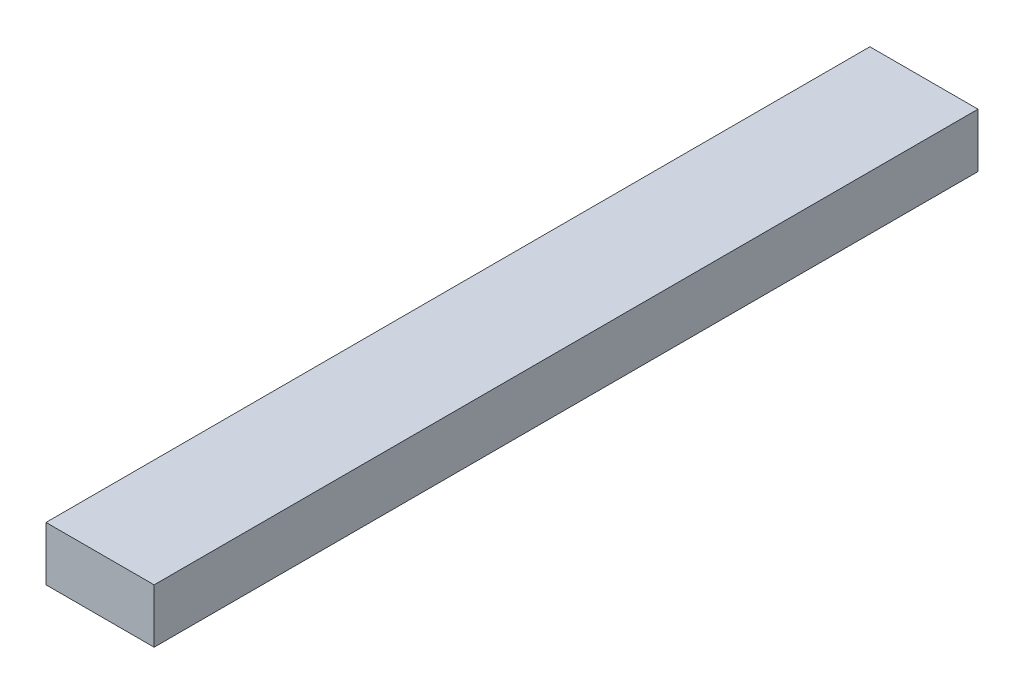
from build123d import *

# Parameters (mm, degrees)
SKETCH1_W           = 60
SKETCH1_H           = 30
BOSS_EXTRUDE1_DEPTH = 228.6


with BuildPart() as part:
    # Sketch1 → Boss-Extrude1 (new, symmetric)
    with BuildSketch(Plane.XY):
        Rectangle(SKETCH1_W, SKETCH1_H)
    extrude(amount=BOSS_EXTRUDE1_DEPTH, both=True)


solid = part.part
